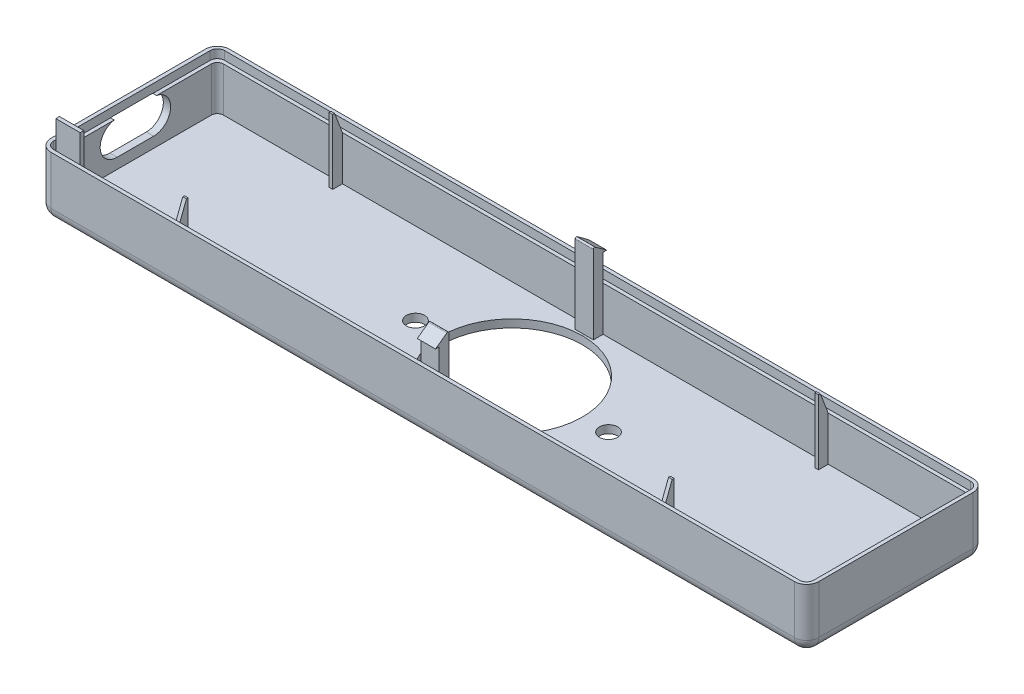
from build123d import *

# Parameters (mm, degrees)
SKETCH1_W            = 160.5788
SKETCH1_H            = 37.338
BOSS_EXTRUDE1_DEPTH  = 12.7
SKETCH2_W            = 157.5308
SKETCH2_H            = 34.29
CUT_EXTRUDE3_DEPTH   = 11.049
FILLET1_R            = 2.54
FILLET2_R            = 1.27
CUT_EXTRUDE4_REACH   = 164.158
SKETCH4_W            = 159.0548
SKETCH4_H            = 35.814
CUT_EXTRUDE5_DEPTH   = 1.778
FILLET3_R            = 1.524
SKETCH5_W            = 5.08
SKETCH5_H            = 0.762
BOSS_EXTRUDE2_DEPTH  = 7.62
SKETCH6_W            = 0.762
SKETCH6_H            = 2.032
BOSS_EXTRUDE3_DEPTH  = 13.589
LPATTERN1_COUNT      = 2
LPATTERN1_PITCH      = 101.6
LPATTERN1_COUNT_DIR2 = 2
LPATTERN1_PITCH_DIR2 = 32.258
CUT_EXTRUDE6_REACH   = 133.936
SKETCH8_W            = 3.81
SKETCH8_H            = 2.032
BOSS_EXTRUDE4_DEPTH  = 14.859
BOSS_EXTRUDE9_DEPTH  = 3.81
FILLET4_R            = 0.254
FILLET4_OF_MIRROR2_R = 0.254
SKETCH10_R           = 14.732
SKETCH10_R_2         = 1.905
CUT_EXTRUDE7_DEPTH   = 85.490976307


with BuildPart() as part:
    # Sketch1 → Boss-Extrude1 (new body)
    with BuildSketch(Plane(origin=(0, 0, 0), x_dir=(1, 0, 0), z_dir=(0, 1, 0))):
        Rectangle(SKETCH1_W, SKETCH1_H)
    extrude(amount=BOSS_EXTRUDE1_DEPTH)

    # Sketch2 → Cut-Extrude3 (cut)
    with BuildSketch(Plane(origin=(0, 12.7, 0), x_dir=(1, 0, 0), z_dir=(0, 1, 0))):
        Rectangle(SKETCH2_W, SKETCH2_H)
    extrude(amount=-CUT_EXTRUDE3_DEPTH, mode=Mode.SUBTRACT)

    # Fillet1
    fillet1_edges = [part.edges().sort_by_distance(p)[0] for p in [
        (0, 0, 18.669),
        (-80.2894, 0, 0),
        (0, 0, -18.669),
        (80.2894, 0, 0),
        (80.2894, 6.35, 18.669),
        (-80.2894, 6.35, 18.669),
        (-80.2894, 6.35, -18.669),
        (80.2894, 6.35, -18.669),
    ]]
    fillet(fillet1_edges, radius=FILLET1_R)

    # Fillet2
    fillet2_edges = [part.edges().sort_by_distance(p)[0] for p in [
        (-78.7654, 7.1755, -17.145),
        (-78.7654, 7.1755, 17.145),
        (78.7654, 7.1755, 17.145),
        (78.7654, 7.1755, -17.145),
    ]]
    fillet(fillet2_edges, radius=FILLET2_R)

    # Sketch3 → Cut-Extrude4 (cut, up to next)
    with BuildSketch(Plane.ZY.offset(80.2894), mode=Mode.PRIVATE) as cut_extrude4_sk1:
        with BuildLine():
            Line((3.81, 3.8633146), (-3.81, 3.8633146))
            ThreePointArc((-3.81, 3.8633146), (-7.366, 7.4193146), (-3.81, 10.9753146))
            Line((-3.81, 10.9753146), (3.81, 10.9753146))
            ThreePointArc((3.81, 10.9753146), (7.366, 7.4193146), (3.81, 3.8633146))
        make_face()
    cut_extrude4_tool1 = extrude(cut_extrude4_sk1.sketch, amount=-CUT_EXTRUDE4_REACH, mode=Mode.PRIVATE) & part.part
    add(cut_extrude4_tool1.solids().sort_by_distance((-80.2894, 7.419315, 0))[0], mode=Mode.SUBTRACT)

    # Sketch4 → Cut-Extrude5 (cut)
    with BuildSketch(Plane(origin=(0, 12.7, 0), x_dir=(1, 0, 0), z_dir=(0, 1, 0))):
        Rectangle(SKETCH4_W, SKETCH4_H)
    extrude(amount=-CUT_EXTRUDE5_DEPTH, mode=Mode.SUBTRACT)

    # Fillet3
    fillet3_edges = [part.edges().sort_by_distance(p)[0] for p in [
        (-79.5274, 11.811, 17.907),
        (-79.5274, 11.811, -17.907),
        (79.5274, 11.811, -17.907),
        (79.5274, 11.811, 17.907),
    ]]
    fillet(fillet3_edges, radius=FILLET3_R)

    # Sketch5 → Boss-Extrude2 (add)
    with BuildSketch(Plane(origin=(0, 10.922, 0), x_dir=(1, 0, 0), z_dir=(0, 1, 0))):
        with Locations((-74.9554, -17.526)):
            Rectangle(SKETCH5_W, SKETCH5_H)
    extrude(amount=BOSS_EXTRUDE2_DEPTH)

    # Sketch6 → Boss-Extrude3 (add)
    with BuildSketch(Plane(origin=(0, 1.651, 0), x_dir=(1, 0, 0), z_dir=(0, 1, 0))):
        with Locations((-52.9844, 16.129)):
            Rectangle(SKETCH6_W, SKETCH6_H)
    boss_extrude3 = extrude(amount=BOSS_EXTRUDE3_DEPTH)

    # LPattern1: Boss-Extrude3 2 × 2
    with Locations(*[(i * LPATTERN1_PITCH, 0, j * LPATTERN1_PITCH_DIR2) for i in range(LPATTERN1_COUNT) for j in range(LPATTERN1_COUNT_DIR2) if (i, j) != (0, 0)]):
        add(boss_extrude3)

    # Cut-Extrude6: up to this face of the body (flat: up to its plane)
    cut_extrude6_end = Plane(part.part.faces().sort_by_distance((-53.3654, 8.4455, -16.129))[0])
    # Sketch7 → Cut-Extrude6 (cut, up to the picked face)
    with BuildSketch(Plane(origin=(48.9966, 0, 0), x_dir=(0, 0, -1), z_dir=(1, 0, 0)), mode=Mode.PRIVATE) as cut_extrude6_sk1:
        Polygon((17.145, 10.922), (15.494, 15.24), (17.145, 15.24), align=None)
    cut_extrude6_tool1 = split(extrude(cut_extrude6_sk1.sketch, amount=-CUT_EXTRUDE6_REACH, mode=Mode.PRIVATE), bisect_by=cut_extrude6_end, keep=Keep.BOTH, mode=Mode.PRIVATE)
    cut_extrude6 = cut_extrude6_tool1.solids().sort_by(Axis((48.9966, 13.800667, -16.594667), (-1, 0, 0)))[0]
    add(cut_extrude6, mode=Mode.SUBTRACT)

    # Mirror1: Cut-Extrude6 across plane
    add(cut_extrude6.mirror(Plane.XY), mode=Mode.SUBTRACT)

    # Sketch8 → Boss-Extrude4 (add)
    with BuildSketch(Plane(origin=(0, 1.651, 0), x_dir=(1, 0, 0), z_dir=(0, 1, 0))):
        with Locations((0, -16.129)):
            Rectangle(SKETCH8_W, SKETCH8_H)
        with Locations((0, 16.129)):
            Rectangle(SKETCH8_W, SKETCH8_H)
    extrude(amount=BOSS_EXTRUDE4_DEPTH)

    # Sketch9 → Boss-Extrude9 (add)
    with BuildSketch(Plane(origin=(1.905, 0, 0), x_dir=(0, 0, -1), z_dir=(1, 0, 0))):
        Polygon((-15.113, 16.51), (-17.907, 16.51), (-15.113, 18.542), align=None)
    boss_extrude9 = extrude(amount=-BOSS_EXTRUDE9_DEPTH)

    # Fillet4
    fillet4_edges = [part.edges().sort_by_distance(p)[0] for p in [
        (0, 18.542, 15.113),
    ]]
    fillet(fillet4_edges, radius=FILLET4_R)

    # Mirror2: Boss-Extrude9 across plane
    add(boss_extrude9.mirror(Plane.XY))

    # Fillet4 of Mirror2
    fillet4_of_mirror2_edges = [part.edges().sort_by_distance(p)[0] for p in [
        (0, 18.542, -15.113),
    ]]
    fillet(fillet4_of_mirror2_edges, radius=FILLET4_OF_MIRROR2_R)

    # Sketch10 → Cut-Extrude7 (cut, through all)
    with BuildSketch(Plane.XZ):
        with Locations(Location((0, 0, 0), (0, 0, 270))):
            Circle(SKETCH10_R)
        with Locations(Location((-20.193, 0, 0), (0, 0, 270))):
            Circle(SKETCH10_R_2)
        with Locations(Location((20.193, 0, 0), (0, 0, 270))):
            Circle(SKETCH10_R_2)
    extrude(amount=-CUT_EXTRUDE7_DEPTH, mode=Mode.SUBTRACT)


solid = part.part
